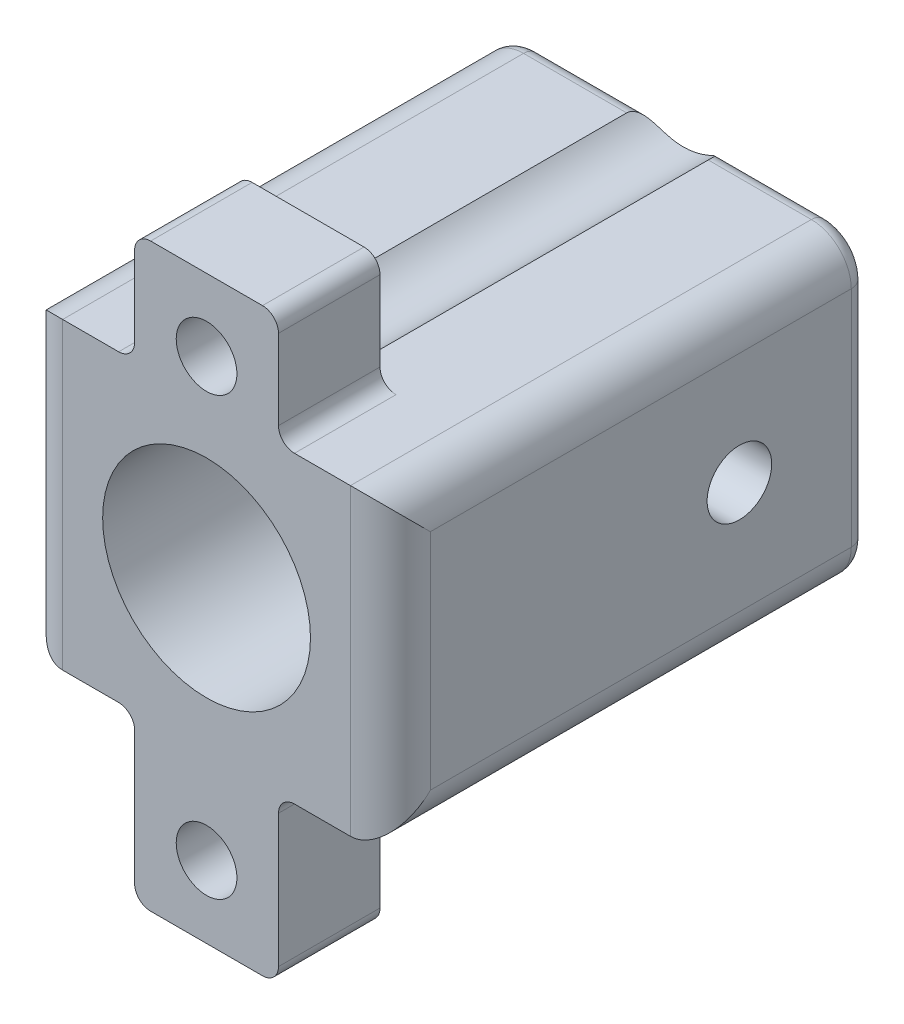
from build123d import *

# Parameters (mm, degrees)
SKETCH1_W                                      = 23
SKETCH1_H                                      = 19
SKETCH1_W_2                                    = 8
SKETCH1_H_2                                    = 8
TOP_DEPTH                                      = 3
SKETCH1_4_W                                    = 23
SKETCH1_4_H                                    = 19
SKETCH1_4_R                                    = 6.5
BODY_DEPTH                                     = 29.83
TABS_START                                     = 23.48
SKETCH1_6_W                                    = 9
SKETCH1_6_H                                    = 7
SKETCH1_6_H_2                                  = 10.3075
TABS_DEPTH                                     = 6.35
F_36_0_1065_DIA_SET_SCREW_D                    = 4.0386
F_36_0_1065_DIA_SET_SCREW_DEPTH                = 4.826
F_36_0_1065_DIA_SET_SCREW_TIP                  = 1.213317848
CBORE_FOR_6_SOCKET_HEAD_CAP_SCREW1_D           = 3.7973
CBORE_FOR_6_SOCKET_HEAD_CAP_SCREW1_CBORE_D     = 7.14502
CBORE_FOR_6_SOCKET_HEAD_CAP_SCREW1_CBORE_DEPTH = 26.9851886
FILLET4_R                                      = 2.5
FILLET5_R                                      = 1


with BuildPart() as part:
    # Sketch1 → Top (new body)
    with BuildSketch(Plane.XY):
        Rectangle(SKETCH1_W, SKETCH1_H)
        Rectangle(SKETCH1_W_2, SKETCH1_H_2, mode=Mode.SUBTRACT)
    extrude(amount=TOP_DEPTH)

    # Sketch1<4> → Body (add)
    with BuildSketch(Plane.XY):
        Rectangle(SKETCH1_4_W, SKETCH1_4_H)
        Circle(SKETCH1_4_R, mode=Mode.SUBTRACT)
    extrude(amount=BODY_DEPTH)

    # Sketch1<6> → Tabs (add)
    with BuildSketch(Plane.XY.offset(TABS_START)):
        with Locations((0, 13)):
            Rectangle(SKETCH1_6_W, SKETCH1_6_H)
        with Locations((0, -14.65375)):
            Rectangle(SKETCH1_6_W, SKETCH1_6_H_2)
    extrude(amount=TABS_DEPTH)

    # #36 (0.1065) Dia. Set Screw
    with Locations(Plane(origin=(11.5, 0, 0), x_dir=(0, 0, -1), z_dir=(1, 0, 0))):
        with Locations((-8, 0)):
            Hole(F_36_0_1065_DIA_SET_SCREW_D / 2, depth=F_36_0_1065_DIA_SET_SCREW_DEPTH)
            with Locations((0, 0, -(F_36_0_1065_DIA_SET_SCREW_DEPTH + F_36_0_1065_DIA_SET_SCREW_TIP / 2))):  # 118° drill point
                Cone(0, F_36_0_1065_DIA_SET_SCREW_D / 2, F_36_0_1065_DIA_SET_SCREW_TIP, mode=Mode.SUBTRACT)

    # CBORE for #6 Socket Head Cap Screw1 (through all)
    with Locations(Plane(origin=(0, 12, 0), x_dir=(-1, 0, 0), z_dir=(0, 0, -1))):
        with Locations((0, 0), (0, -27.3035)):
            CounterBoreHole(CBORE_FOR_6_SOCKET_HEAD_CAP_SCREW1_D / 2, CBORE_FOR_6_SOCKET_HEAD_CAP_SCREW1_CBORE_D / 2, CBORE_FOR_6_SOCKET_HEAD_CAP_SCREW1_CBORE_DEPTH)

    # Fillet4
    fillet4_edges = [part.edges().sort_by_distance(p)[0] for p in [
        (-11.5, 9.5, 14.915),
        (-11.5, -9.5, 14.915),
        (11.5, -9.5, 14.915),
        (11.5, 9.5, 14.915),
        (-11.5, 0, 29.83),
        (11.5, 0, 29.83),
    ]]
    fillet(fillet4_edges, radius=FILLET4_R)

    # Fillet5
    fillet5_edges = [part.edges().sort_by_distance(p)[0] for p in [
        (-11.5, 0, 0),
        (11.5, 0, 0),
        (0, -9.5, 0),
        (-5.776012118, 9.5, 0),
        (10.767766953, 8.767766953, 0),
        (10.767766953, -8.767766953, 0),
        (-10.767766953, -8.767766953, 0),
        (-10.767766953, 8.767766953, 0),
        (-4, 4, 1.5),
        (-4, -4, 1.5),
        (4, -4, 1.5),
        (4, 4, 1.5),
        (-4.5, 16.5, 26.655),
        (-3.526012118, 9.5, 23.48),
        (-4.5, 9.5, 26.655),
        (4.5, 9.5, 26.655),
        (4.5, 16.5, 26.655),
        (4.5, -9.5, 26.655),
        (-4.5, -9.5, 26.655),
        (-4.5, -19.8075, 26.655),
        (4.5, -19.8075, 26.655),
        (0, -9.5, 23.48),
        (5.776012118, 9.5, 0),
    ]]
    fillet(fillet5_edges, radius=FILLET5_R)


solid = part.part
